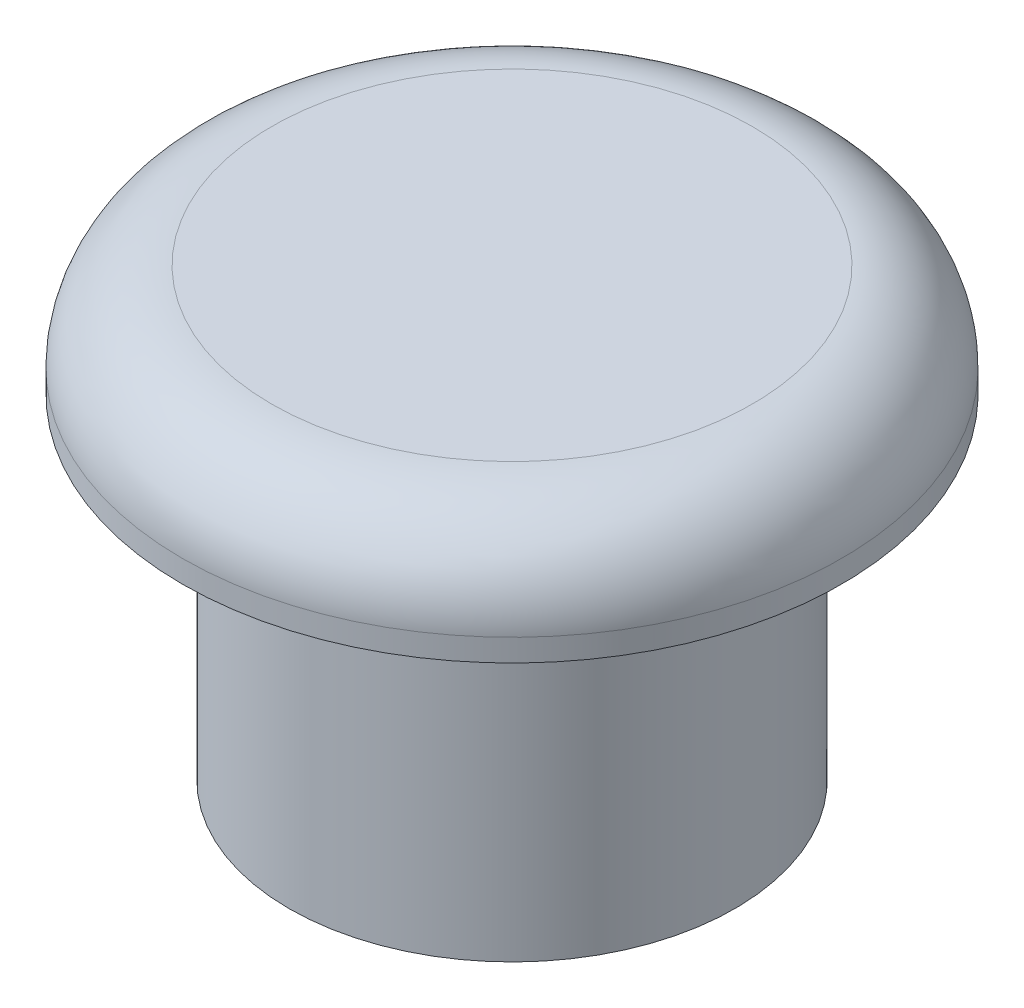
from build123d import *

# Parameters (mm, degrees)
SKETCH1_R           = 2
BOSS_EXTRUDE1_DEPTH = 3
SKETCH2_R           = 2.957342588
BOSS_EXTRUDE2_DEPTH = 1
FILLET1_R           = 0.8


with BuildPart() as part:
    # Sketch1 → Boss-Extrude1 (new body)
    with BuildSketch(Plane(origin=(0, 0, 0), x_dir=(1, 0, 0), z_dir=(0, 1, 0))):
        with Locations(Location((0, 0, 0), (0, 0, 270))):
            Circle(SKETCH1_R)
    extrude(amount=BOSS_EXTRUDE1_DEPTH)

    # Sketch2 → Boss-Extrude2 (add)
    with BuildSketch(Plane(origin=(0, 3, 0), x_dir=(1, 0, 0), z_dir=(0, 1, 0))):
        with Locations(Location((0, 0, 0), (0, 0, 270))):
            Circle(SKETCH2_R)
    extrude(amount=BOSS_EXTRUDE2_DEPTH)

    # Fillet1
    fillet1_edges = [part.edges().sort_by_distance(p)[0] for p in [
        (0, 4, -2.957342588),
    ]]
    fillet(fillet1_edges, radius=FILLET1_R)


solid = part.part
